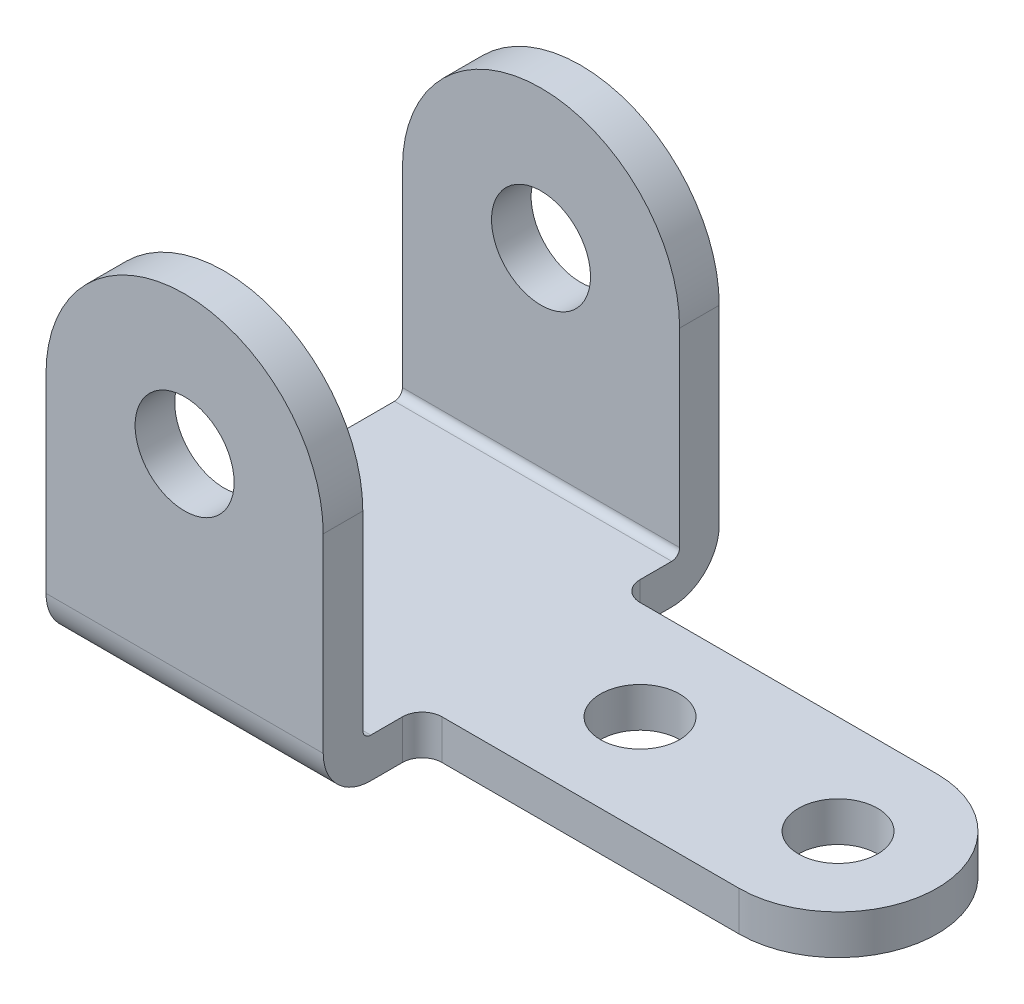
from build123d import *

# Parameters (mm, degrees)
U_SHAPE_DEPTH        = 100
FILLET_2_R           = 12
THICKNESS_T          = -10
SKETCH8_R            = 12.5
INNER_HOLE_DEPTH     = 122.757956619
TONGUE_DEPTH         = 10
SKETCH9_R            = 10
MOUNTING_HOLES_DEPTH = 197.53244007
FILLET1_R            = 5


with BuildPart() as part:
    # Sketch4 → "U" shape (new body)
    with BuildSketch(Plane.XY):
        with BuildLine():
            Line((-35, 0), (-35, -60))
            Line((-35, -60), (35, -60))
            Line((35, -60), (35, 0))
            ThreePointArc((35, 0), (0, 35), (-35, 0))
        make_face()
    extrude(amount=U_SHAPE_DEPTH)

    # Fillet 2
    fillet_2_edges = [part.edges().sort_by_distance(p)[0] for p in [
        (0, -60, 100),
        (0, -60, 0),
    ]]
    fillet(fillet_2_edges, radius=FILLET_2_R)

    # Thickness
    thickness_openings = [part.faces().sort_by_distance(p)[0] for p in [
        (35, -29.715655007, 50),
        (-35, -29.715655007, 50),
        (0, 35, 50),
    ]]
    offset(amount=THICKNESS_T, openings=thickness_openings, kind=Kind.INTERSECTION)

    # Sketch8 → Inner Hole (cut, through all)
    with BuildSketch(Plane.XY.offset(100)):
        Circle(SKETCH8_R)
    extrude(amount=-INNER_HOLE_DEPTH, mode=Mode.SUBTRACT)

    # Sketch7 → Tongue (add)
    with BuildSketch(Plane.XZ.offset(60)):
        with BuildLine():
            Line((35, 25), (115, 25))
            ThreePointArc((115, 25), (140, 50), (115, 75))
            Line((115, 75), (35, 75))
            Line((35, 75), (35, 25))
        make_face()
    extrude(amount=-TONGUE_DEPTH)

    # Sketch9 → Mounting Holes (cut, through all)
    with BuildSketch(Plane.XZ.offset(60)):
        with Locations((65, 50)):
            Circle(SKETCH9_R)
        with Locations((115, 50)):
            Circle(SKETCH9_R)
    extrude(amount=-MOUNTING_HOLES_DEPTH, mode=Mode.SUBTRACT)

    # Fillet1
    fillet1_edges = [part.edges().sort_by_distance(p)[0] for p in [
        (35, -55, 75),
        (35, -55, 25),
    ]]
    fillet(fillet1_edges, radius=FILLET1_R)


solid = part.part
